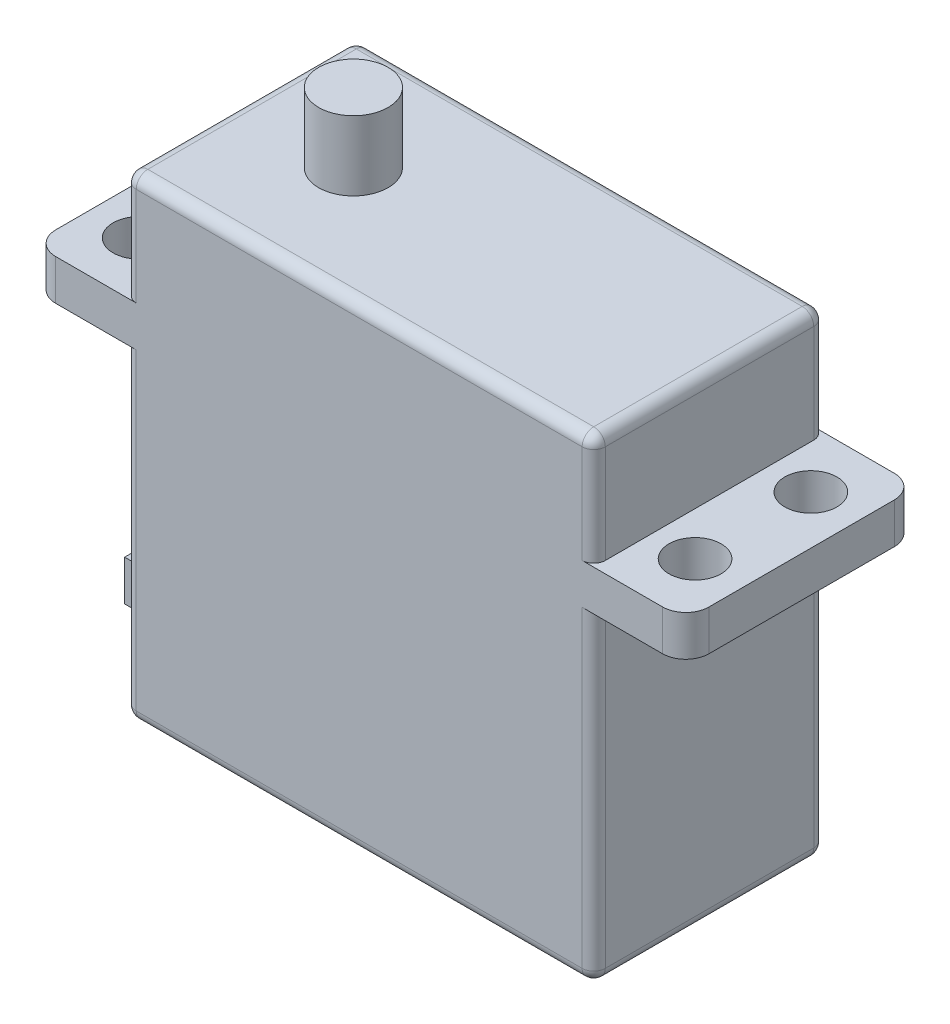
from build123d import *

# Parameters (mm, degrees)
SKETCH1_W           = 40.5
SKETCH1_H           = 20
BOSS_EXTRUDE1_DEPTH = 41
SKETCH2_W           = 56.4
SKETCH2_H           = 20
SKETCH2_R           = 2.25
BOSS_EXTRUDE2_DEPTH = 3.5
SKETCH3_R           = 3
BOSS_EXTRUDE3_DEPTH = 6
SKETCH4_W           = 10
SKETCH4_H           = 3.5
BOSS_EXTRUDE4_DEPTH = 5
FILLET1_R           = 2
FILLET2_R           = 1
FILLET3_R           = 1


with BuildPart() as part:
    # Sketch1 → Boss-Extrude1 (new body)
    with BuildSketch(Plane(origin=(0, 0, 0), x_dir=(1, 0, 0), z_dir=(0, 1, 0))):
        Rectangle(SKETCH1_W, SKETCH1_H)
    extrude(amount=BOSS_EXTRUDE1_DEPTH)

    # Sketch2 → Boss-Extrude2 (add)
    with BuildSketch(Plane(origin=(0, 28, 0), x_dir=(-1, 0, 0), z_dir=(0, -1, 0))):
        Rectangle(SKETCH2_W, SKETCH2_H)
        with Locations(Location((-24, 5, 0), (0, 0, 90))):
            Circle(SKETCH2_R, mode=Mode.SUBTRACT)
        with Locations(Location((24, 5, 0), (0, 0, 90))):
            Circle(SKETCH2_R, mode=Mode.SUBTRACT)
        with Locations(Location((24, -5, 0), (0, 0, 90))):
            Circle(SKETCH2_R, mode=Mode.SUBTRACT)
        with Locations(Location((-24, -5, 0), (0, 0, 90))):
            Circle(SKETCH2_R, mode=Mode.SUBTRACT)
    extrude(amount=-BOSS_EXTRUDE2_DEPTH)

    # Sketch3 → Boss-Extrude3 (add)
    with BuildSketch(Plane(origin=(0, 41, 0), x_dir=(1, 0, 0), z_dir=(0, 1, 0))):
        with Locations(Location((-10.5, 0, 0), (0, 0, 270))):
            Circle(SKETCH3_R)
    extrude(amount=BOSS_EXTRUDE3_DEPTH)

    # Sketch4 → Boss-Extrude4 (add)
    with BuildSketch(Plane.ZY.offset(20.25)):
        with Locations((0, 5.25)):
            Rectangle(SKETCH4_W, SKETCH4_H)
    extrude(amount=BOSS_EXTRUDE4_DEPTH)

    # Fillet1
    fillet1_edges = [part.edges().sort_by_distance(p)[0] for p in [
        (28.2, 29.75, -10),
        (-28.2, 29.75, 10),
        (28.2, 29.75, 10),
        (-28.2, 29.75, -10),
    ]]
    fillet(fillet1_edges, radius=FILLET1_R)

    # Fillet2
    fillet2_edges = [part.edges().sort_by_distance(p)[0] for p in [
        (20.25, 14, 10),
        (-20.25, 14, 10),
        (-20.25, 14, -10),
        (20.25, 14, -10),
        (0, 0, 10),
        (-20.25, 0, 0),
        (0, 0, -10),
        (20.25, 0, 0),
        (-20.25, 36.25, 10),
        (-20.25, 36.25, -10),
    ]]
    fillet(fillet2_edges, radius=FILLET2_R)

    # Fillet3
    fillet3_edges = [part.edges().sort_by_distance(p)[0] for p in [
        (0.5, 41, 10),
        (-20.25, 41, 0),
        (-19.957106781, 41, 9.707106781),
        (-19.957106781, 41, -9.707106781),
        (20.25, 41, 0),
        (20.25, 36.25, 10),
        (20.25, 36.25, -10),
        (0.5, 41, -10),
    ]]
    fillet(fillet3_edges, radius=FILLET3_R)


solid = part.part
